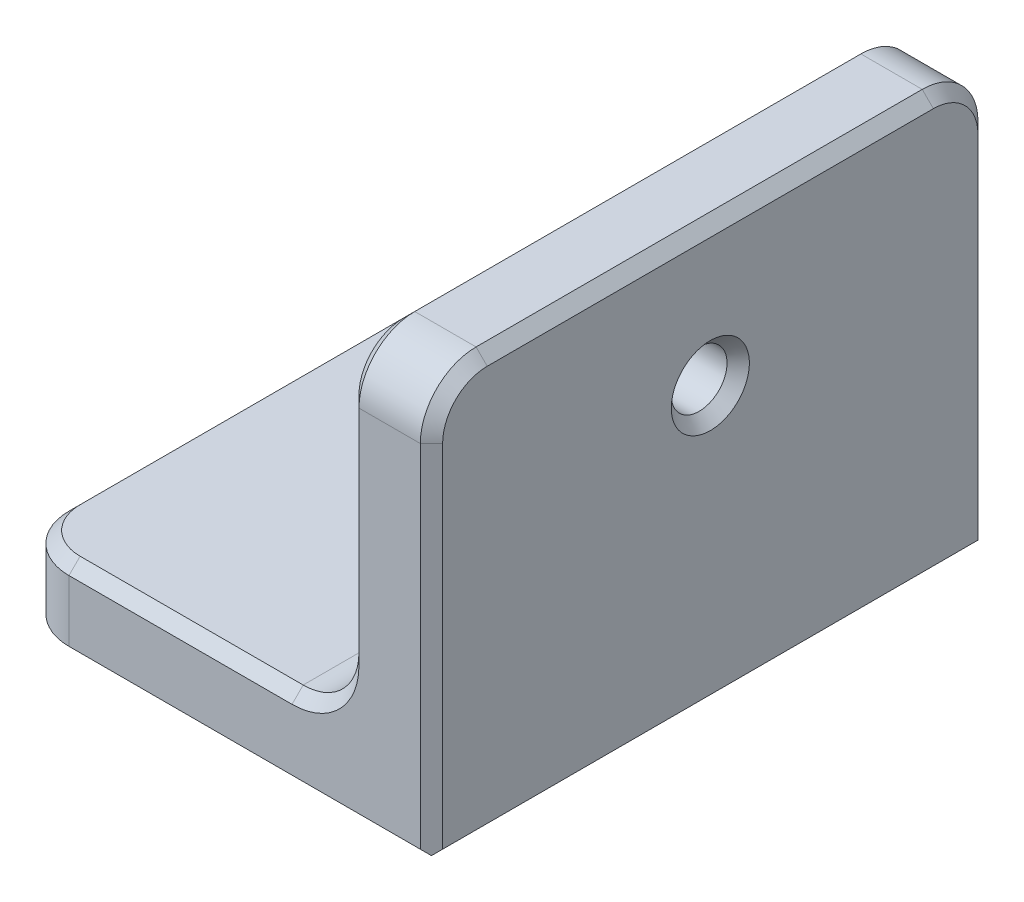
from build123d import *

# Parameters (mm, degrees)
SKETCH_1_W          = 15
SKETCH_1_H          = 20
EXTRUDE_1_DEPTH     = 3
SKETCH_2_R          = 1.6
CUT_EXTRUDE_1_DEPTH = 3
SKETCH_3_W          = 3
SKETCH_3_H          = 20
EXTRUDE_2_DEPTH     = 12
FILLET_1_R          = 2
SKETCH_4_R          = 1
CUT_EXTRUDE_2_DEPTH = 10
FILLET_2_R          = 2
CHAMFER_1_SIZE      = 0.4
CHAMFER_2_SIZE      = 0.4
CHAMFER_3_SIZE      = 0.4


with BuildPart() as part:
    # 草图1 → 凸台-拉伸1 (new body)
    with BuildSketch(Plane(origin=(0, 0, 0), x_dir=(1, 0, 0), z_dir=(0, 1, 0))):
        with Locations((7.5, 10)):
            Rectangle(SKETCH_1_W, SKETCH_1_H)
    extrude(amount=EXTRUDE_1_DEPTH)

    # 草图2 → 切除-拉伸1 (cut)
    with BuildSketch(Plane(origin=(0, 3, 0), x_dir=(1, 0, 0), z_dir=(0, 1, 0))):
        with Locations(Location((5.5, 10, 0), (0, 0, 270))):
            Circle(SKETCH_2_R)
    extrude(amount=-CUT_EXTRUDE_1_DEPTH, mode=Mode.SUBTRACT)

    # 草图3 → 凸台-拉伸2 (add)
    with BuildSketch(Plane(origin=(0, 3, 0), x_dir=(1, 0, 0), z_dir=(0, 1, 0))):
        with Locations((13.5, 10)):
            Rectangle(SKETCH_3_W, SKETCH_3_H)
    extrude(amount=EXTRUDE_2_DEPTH)

    # 圆角1
    fillet_1_edges = [part.edges().sort_by_distance(p)[0] for p in [
        (12, 3, -10),
    ]]
    fillet(fillet_1_edges, radius=FILLET_1_R)

    # 草图4 → 切除-拉伸2 (cut)
    with BuildSketch(Plane.ZY.offset(-12)):
        with Locations((-10, 10)):
            Circle(SKETCH_4_R)
    extrude(amount=-CUT_EXTRUDE_2_DEPTH, mode=Mode.SUBTRACT)

    # 圆角2
    fillet_2_edges = [part.edges().sort_by_distance(p)[0] for p in [
        (13.5, 15, -20),
        (13.5, 15, 0),
        (0, 1.5, -20),
        (0, 1.5, 0),
    ]]
    fillet(fillet_2_edges, radius=FILLET_2_R)

    # 倒角1
    chamfer_1_edges = [part.edges().sort_by_distance(p)[0] for p in [
        (5.5, 0, -11.6),
        (8.5, 0, -20),
        (8.5, 0, 0),
        (15, 0, -10),
        (0, 0, -10),
        (0.585786438, 0, -19.414213562),
        (0.585786438, 0, -0.585786438),
    ]]
    chamfer(chamfer_1_edges, length=CHAMFER_1_SIZE)

    # 倒角2
    chamfer_2_edges = [part.edges().sort_by_distance(p)[0] for p in [
        (15, 15, -10),
        (15, 6.7, -20),
        (15, 6.7, 0),
        (15, 14.414213562, -0.585786438),
        (15, 14.414213562, -19.414213562),
    ]]
    chamfer(chamfer_2_edges, length=CHAMFER_2_SIZE)

    # 倒角3
    chamfer_3_edges = [part.edges().sort_by_distance(p)[0] for p in [
        (6, 3, -20),
        (11.414213562, 3.585786438, 0),
        (11.414213562, 3.585786438, -20),
        (15, 10, -11),
        (12, 10, -11),
        (12, 15, -10),
        (12, 9, -20),
        (12, 9, 0),
        (12, 14.414213562, -0.585786438),
        (12, 14.414213562, -19.414213562),
        (6, 3, 0),
        (0, 3, -10),
        (0.585786438, 3, -19.414213562),
        (0.585786438, 3, -0.585786438),
    ]]
    chamfer(chamfer_3_edges, length=CHAMFER_3_SIZE)


solid = part.part
